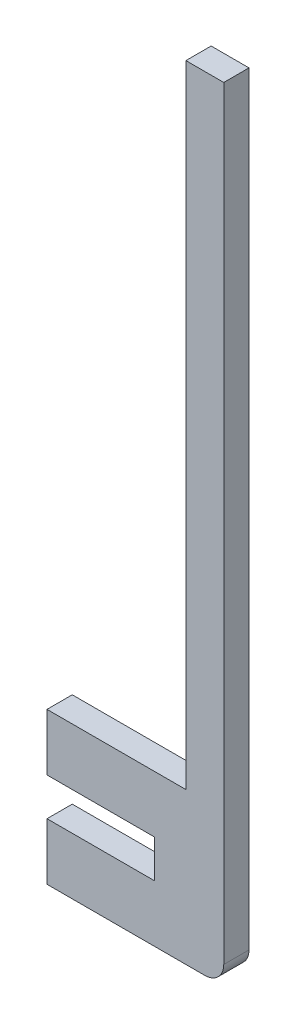
from build123d import *

# Parameters (mm, degrees)
BOSS_EXTRUDE1_DEPTH = 2


with BuildPart() as part:
    # Sketch1 → Boss-Extrude1 (new body)
    with BuildSketch(Plane.XY):
        with BuildLine():
            Line((0, 0), (0, 4.5))
            Line((0, 4.5), (8.5, 4.5))
            Line((8.5, 4.5), (8.5, 7.5))
            Line((8.5, 7.5), (0, 7.5))
            Line((0, 7.5), (0, 12))
            Line((0, 12), (11, 12))
            Line((11, 12), (11, 62))
            Line((11, 62), (14, 62))
            Line((14, 62), (14, 1.5))
            ThreePointArc((14, 1.5), (13.560660172, 0.439339828), (12.5, 0))
            Line((12.5, 0), (11, 0))
            Line((11, 0), (0, 0))
        make_face()
    extrude(amount=BOSS_EXTRUDE1_DEPTH)


solid = part.part
